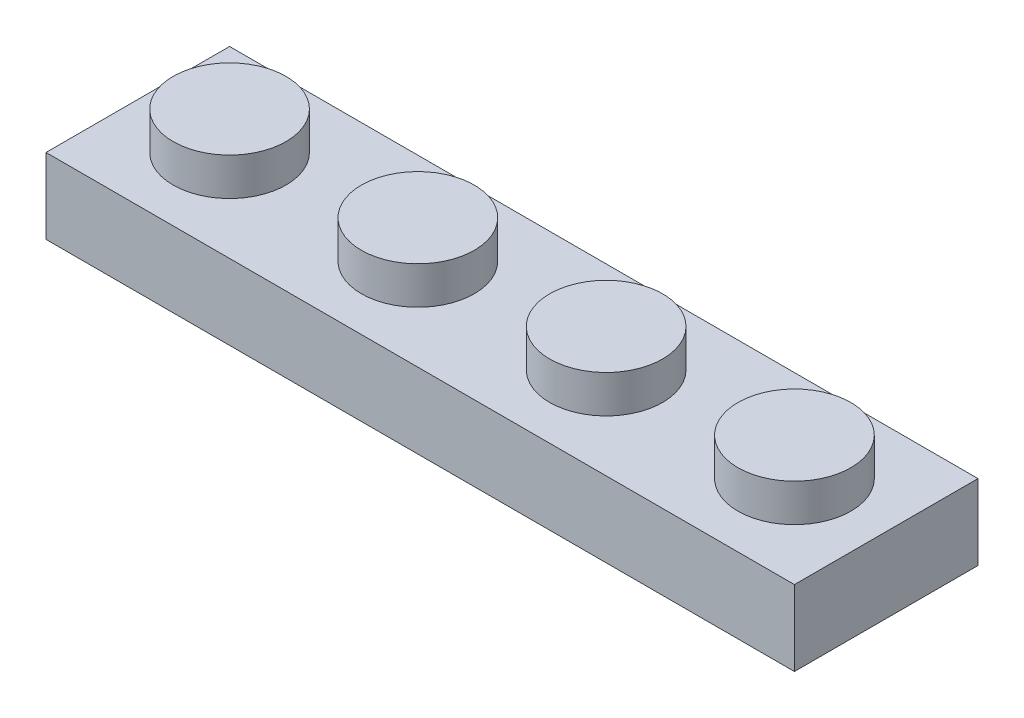
from build123d import *

# Parameters (mm, degrees)
SKETCH1_W            = 31.8
SKETCH1_H            = 3.2
BOSS_EXTRUDE1_DEPTH  = 7.8
SKETCH2_R            = 2.4
BOSS_EXTRUDE2_DEPTH  = 1.6
LPATTERN1_COUNT      = 2
LPATTERN1_PITCH      = 8
LPATTERN1_COUNT_DIR2 = 6
LPATTERN1_PITCH_DIR2 = 8
SHELL1_T             = -1.2
SKETCH3_R            = 1.5
SKETCH3_R_2          = 0.6
BOSS_EXTRUDE3_DEPTH  = 1.8
LPATTERN2_COUNT      = 3
LPATTERN2_PITCH      = 8


with BuildPart() as part:
    # Sketch1 → Boss-Extrude1 (new body)
    with BuildSketch(Plane.XY):
        with Locations((15.9, 1.6)):
            Rectangle(SKETCH1_W, SKETCH1_H)
    extrude(amount=-BOSS_EXTRUDE1_DEPTH)

    # Sketch2 → Boss-Extrude2 (add)
    with BuildSketch(Plane(origin=(0, 3.2, 0), x_dir=(1, 0, 0), z_dir=(0, 1, 0))):
        with Locations(Location((3.9, 3.9, 0), (0, 0, 270))):
            Circle(SKETCH2_R)
    boss_extrude2 = extrude(amount=BOSS_EXTRUDE2_DEPTH)

    # LPattern1: Boss-Extrude2 2 × 6, 8 skipped
    with Locations(*[(j * LPATTERN1_PITCH_DIR2, 0, i * LPATTERN1_PITCH) for i in range(LPATTERN1_COUNT) for j in range(LPATTERN1_COUNT_DIR2) if (i, j) not in ((0, 0), (0, 4), (0, 5), (1, 0), (1, 1), (1, 2), (1, 3), (1, 4), (1, 5))]):
        add(boss_extrude2)

    # Shell1
    shell1_openings = [part.faces().sort_by_distance(p)[0] for p in [
        (15.9, 0, -3.9),
    ]]
    offset(amount=SHELL1_T, openings=shell1_openings, kind=Kind.INTERSECTION)

    # Sketch3 → Boss-Extrude3 (add)
    with BuildSketch(Plane.XZ.offset(-2)):
        with Locations(Location((23.9, -3.9, 0), (0, 0, 90))):
            Circle(SKETCH3_R)
        with Locations(Location((23.9, -3.9, 0), (0, 0, 270))):
            Circle(SKETCH3_R_2, mode=Mode.SUBTRACT)
    boss_extrude3 = extrude(amount=BOSS_EXTRUDE3_DEPTH)

    # LPattern2: Boss-Extrude3 ×3
    with Locations(*[(-i * LPATTERN2_PITCH, 0, 0) for i in range(1, LPATTERN2_COUNT)]):
        add(boss_extrude3)


solid = part.part
